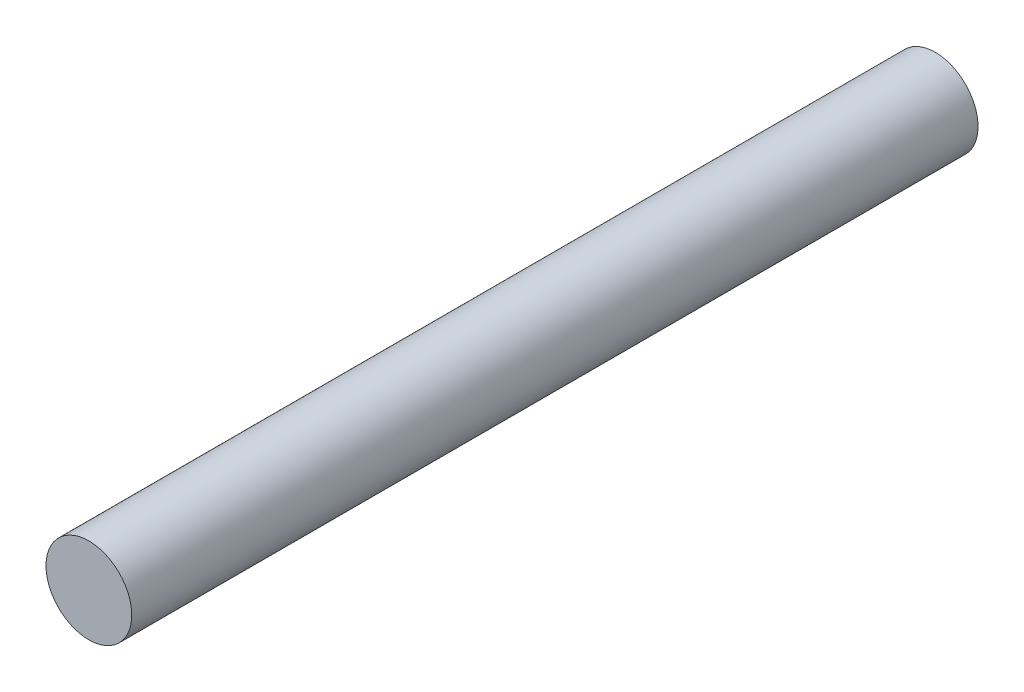
from build123d import *

# Parameters (mm, degrees)
SKETCH1_R           = 6.25
BOSS_EXTRUDE1_DEPTH = 123.4


with BuildPart() as part:
    # Sketch1 → Boss-Extrude1 (new body)
    with BuildSketch(Plane.XY):
        with Locations(Location((221.855607159, -9.487655797, 0), (0, 0, 180))):
            Circle(SKETCH1_R)
    extrude(amount=BOSS_EXTRUDE1_DEPTH)


solid = part.part
